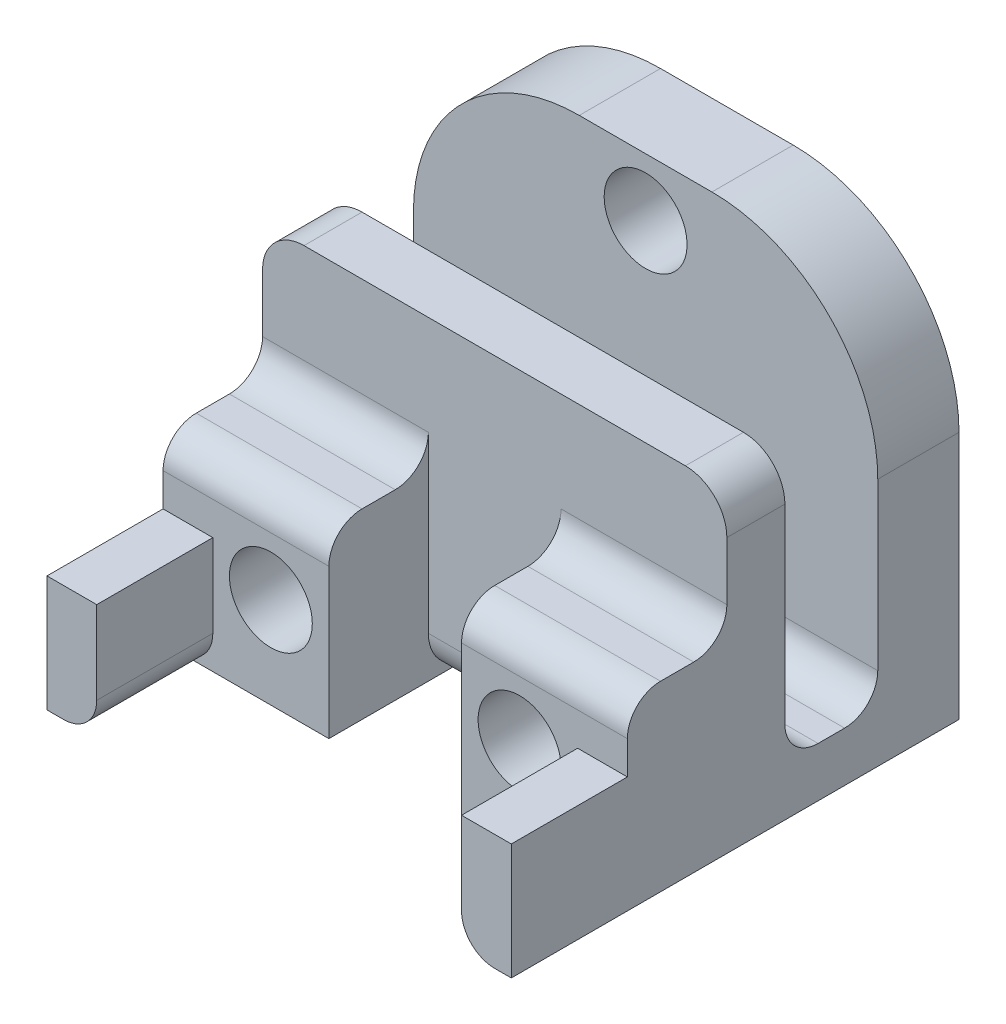
from build123d import *

# Parameters (mm, degrees)
BOSS_EXTRUDE1_DEPTH = 8.89
SKETCH2_W           = 35.56
SKETCH2_H           = 17.78
BOSS_EXTRUDE2_DEPTH = 22.86
SKETCH4_W           = 35.56
SKETCH4_H           = 7.112
CUT_EXTRUDE2_DEPTH  = 27.94
SKETCH5_W           = 35.56
SKETCH5_H           = 4.445
CUT_EXTRUDE3_DEPTH  = 7.62
SKETCH6_R           = 3.175
CUT_EXTRUDE4_DEPTH  = 6.35
FILLET1_R           = 12.7
FILLET2_R           = 3.175
FILLET3_R           = 3.175
FILLET6_R           = 2.54
BOSS_EXTRUDE5_DEPTH = 5.08
SKETCH14_R          = 3.175
CUT_EXTRUDE8_DEPTH  = 9.525
FILLET7_R           = 2.54


with BuildPart() as part:
    # Sketch1 → Boss-Extrude1 (new body)
    with BuildSketch(Plane(origin=(0, 0, 0), x_dir=(1, 0, 0), z_dir=(0, 1, 0))):
        Polygon((0, 25.4), (0, 0), (0, -8.89), (3.81, -8.89), (3.81, 0), (12.7, 0), (12.7, 7.62), (22.86, 7.62), (22.86, 0), (31.75, 0), (31.75, -8.89), (35.56, -8.89), (35.56, 0), (35.56, 25.4), align=None)
    extrude(amount=BOSS_EXTRUDE1_DEPTH)

    # Sketch2 → Boss-Extrude2 (add)
    with BuildSketch(Plane(origin=(0, 8.89, 0), x_dir=(1, 0, 0), z_dir=(0, 1, 0))):
        with Locations((17.78, 16.51)):
            Rectangle(SKETCH2_W, SKETCH2_H)
    extrude(amount=BOSS_EXTRUDE2_DEPTH)

    # Sketch4 → Cut-Extrude2 (cut)
    with BuildSketch(Plane(origin=(0, 31.75, 0), x_dir=(1, 0, 0), z_dir=(0, 1, 0))):
        with Locations((17.78, 15.621)):
            Rectangle(SKETCH4_W, SKETCH4_H)
    extrude(amount=-CUT_EXTRUDE2_DEPTH, mode=Mode.SUBTRACT)

    # Sketch5 → Cut-Extrude3 (cut)
    with BuildSketch(Plane(origin=(0, 31.75, 0), x_dir=(1, 0, 0), z_dir=(0, 1, 0))):
        with Locations((17.78, 9.8425)):
            Rectangle(SKETCH5_W, SKETCH5_H)
    extrude(amount=-CUT_EXTRUDE3_DEPTH, mode=Mode.SUBTRACT)

    # Sketch6 → Cut-Extrude4 (cut)
    with BuildSketch(Plane(origin=(0, 0, -25.4), x_dir=(-1, 0, 0), z_dir=(0, 0, -1))):
        with Locations((-17.78, 27.305)):
            Circle(SKETCH6_R)
    extrude(amount=-CUT_EXTRUDE4_DEPTH, mode=Mode.SUBTRACT)

    # Fillet1
    fillet1_edges = [part.edges().sort_by_distance(p)[0] for p in [
        (0, 31.75, -22.2885),
        (35.56, 31.75, -22.2885),
    ]]
    fillet(fillet1_edges, radius=FILLET1_R)

    # Fillet2
    fillet2_edges = [part.edges().sort_by_distance(p)[0] for p in [
        (0, 24.13, -9.8425),
        (35.56, 24.13, -9.8425),
    ]]
    fillet(fillet2_edges, radius=FILLET2_R)

    # Fillet3
    fillet3_edges = [part.edges().sort_by_distance(p)[0] for p in [
        (17.78, 0, -7.62),
    ]]
    fillet(fillet3_edges, radius=FILLET3_R)

    # Fillet6
    fillet6_edges = [part.edges().sort_by_distance(p)[0] for p in [
        (3.81, 0, 4.445),
        (31.75, 0, 4.445),
        (17.78, 3.81, -12.065),
        (17.78, 3.81, -19.177),
    ]]
    fillet(fillet6_edges, radius=FILLET6_R)

    # Sketch13 → Boss-Extrude5 (add)
    with BuildSketch(Plane(origin=(0, 8.89, 0), x_dir=(1, 0, 0), z_dir=(0, 1, 0))):
        Polygon((3.81, 0), (0, 0), (0, 7.62), (12.7, 7.62), (12.7, 0), align=None)
        Polygon((35.56, 7.62), (22.86, 7.62), (22.86, 0), (31.75, 0), (35.56, 0), align=None)
    extrude(amount=BOSS_EXTRUDE5_DEPTH)

    # Sketch14 → Cut-Extrude8 (cut)
    with BuildSketch(Plane.XY):
        with Locations((8.255, 6.985)):
            Circle(SKETCH14_R)
        with Locations((27.305, 6.985)):
            Circle(SKETCH14_R)
    extrude(amount=-CUT_EXTRUDE8_DEPTH, mode=Mode.SUBTRACT)

    # Fillet7
    fillet7_edges = [part.edges().sort_by_distance(p)[0] for p in [
        (29.21, 13.97, -7.62),
        (6.35, 13.97, -7.62),
        (29.21, 13.97, 0),
        (6.35, 13.97, 0),
    ]]
    fillet(fillet7_edges, radius=FILLET7_R)


solid = part.part
